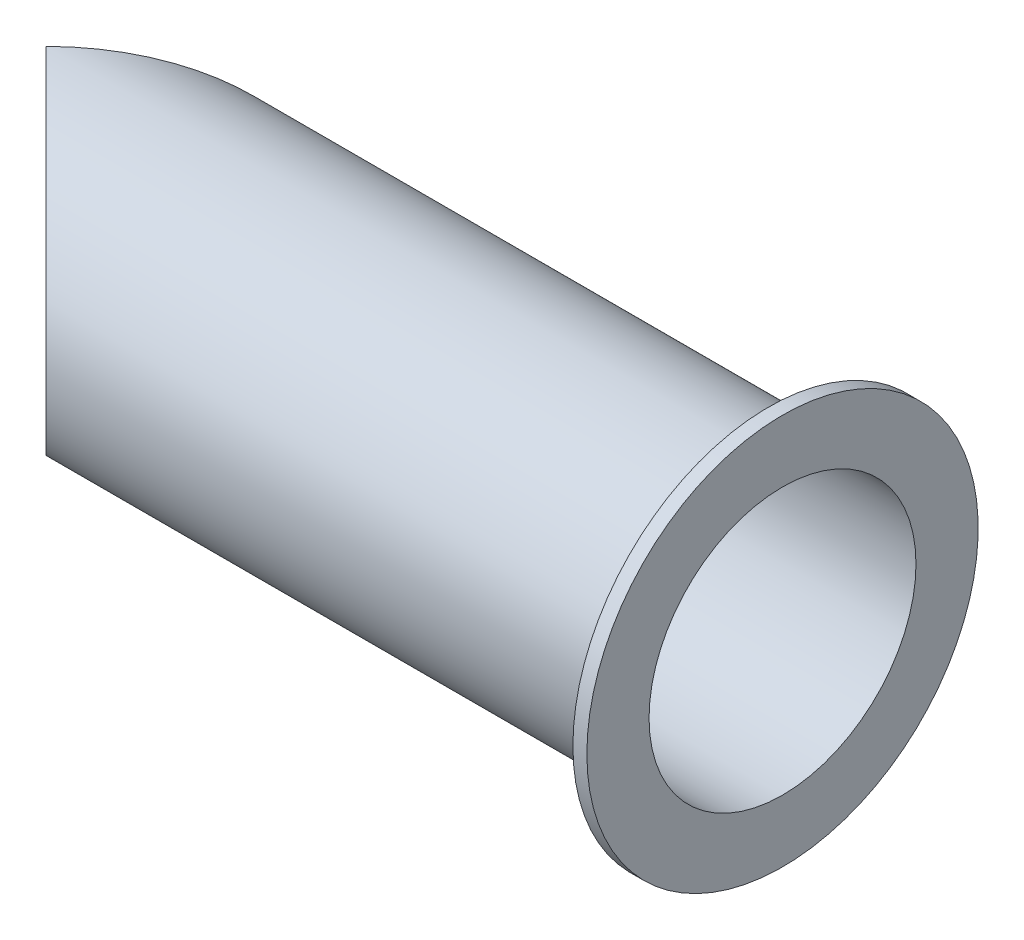
from build123d import *

# Parameters (mm, degrees)
CUT_EXTRUDE1_DEPTH      = 47.613731882
CUT_EXTRUDE1_DEPTH_BACK = 47.613731882


with BuildPart() as part:
    # Sketch1 → Revolve1 (revolve)
    with BuildSketch(Plane.XY):
        with BuildLine():
            Line((41.2, 10.5), (-10.5, 10.5))
            ThreePointArc((-10.5, 10.5), (-8.266728857, 10.259751459), (-6.135655834, 9.55))
            Line((-6.135655834, 9.55), (42.2, 9.55))
            Line((42.2, 9.55), (42.2, 14))
            Line((42.2, 14), (41.2, 14))
            Line((41.2, 14), (41.2, 10.5))
        make_face()
    revolve(axis=Axis((0, 0, 0), (1, 0, 0)))

    # Sketch1<3> → Cut-Extrude1 (cut, two sides: drawn at the far end of the back side and taken through both)
    with BuildSketch(Plane.XY.offset(-CUT_EXTRUDE1_DEPTH_BACK)):
        with BuildLine():
            ThreePointArc((-10.5, -10.5), (0, 0), (-10.5, 10.5))
            Line((-10.5, 10.5), (-10.5, -10.5))
        make_face()
    extrude(amount=CUT_EXTRUDE1_DEPTH + CUT_EXTRUDE1_DEPTH_BACK, mode=Mode.SUBTRACT)


solid = part.part
